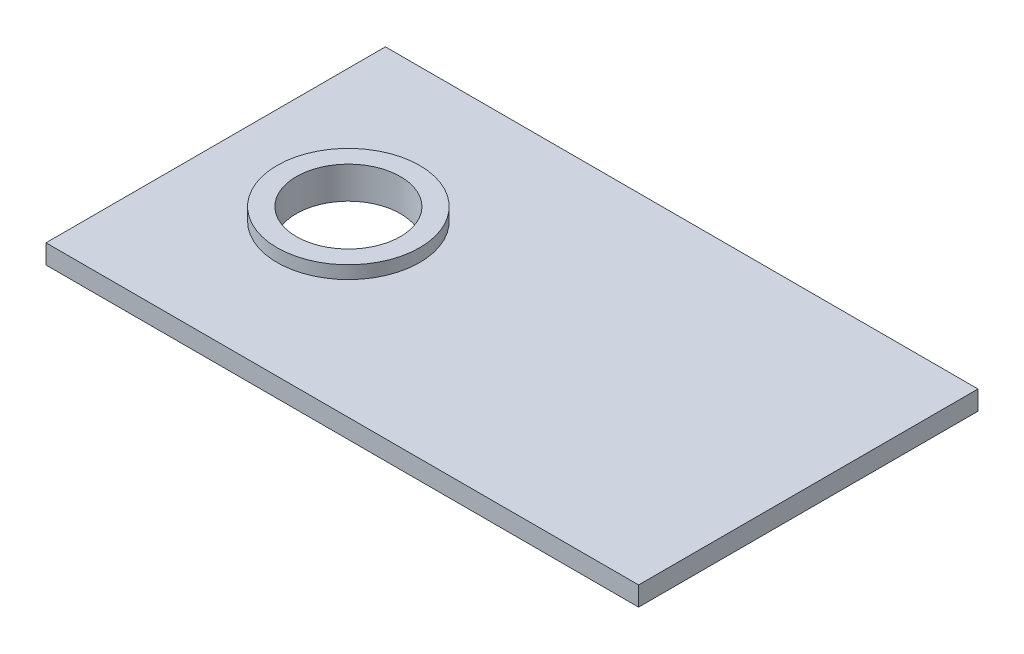
from build123d import *

# Parameters (mm, degrees)
SKETCH1_W           = 92.252714028
SKETCH1_H           = 52.835645306
SKETCH1_R           = 8.1
BOSS_EXTRUDE1_DEPTH = 3
SKETCH2_R           = 11.1
SKETCH2_R_2         = 8.1
BOSS_EXTRUDE2_DEPTH = 2


with BuildPart() as part:
    # Sketch1 → Boss-Extrude1 (new body)
    with BuildSketch(Plane(origin=(0, 0, 0), x_dir=(1, 0, 0), z_dir=(0, 1, 0))):
        Rectangle(SKETCH1_W, SKETCH1_H)
        with Locations(Location((-25.470998192, 0, 0), (0, 0, 270))):
            Circle(SKETCH1_R, mode=Mode.SUBTRACT)
    extrude(amount=BOSS_EXTRUDE1_DEPTH)

    # Sketch2 → Boss-Extrude2 (add)
    with BuildSketch(Plane(origin=(0, 3, 0), x_dir=(1, 0, 0), z_dir=(0, 1, 0))):
        with Locations(Location((-25.470998192, 0, 0), (0, 0, 90))):
            Circle(SKETCH2_R)
        with Locations(Location((-25.470998192, 0, 0), (0, 0, 270))):
            Circle(SKETCH2_R_2, mode=Mode.SUBTRACT)
    extrude(amount=BOSS_EXTRUDE2_DEPTH)


solid = part.part
